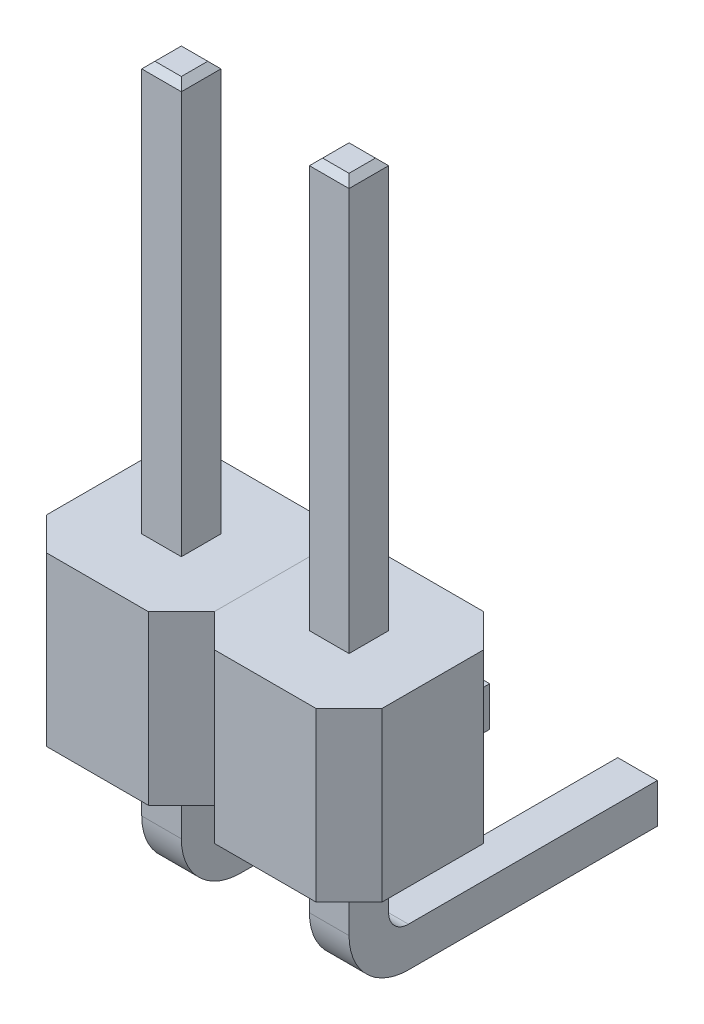
from build123d import *

# Parameters (mm, degrees)
CONTACT_DEPTH          = 0.3
CHAMFER1_SIZE          = 0.1
PLASTIC_DEPTH          = 2.54
PATTERN_LINEAR_2_COUNT = 2
PATTERN_LINEAR_2_PITCH = 2.54


with BuildPart() as part:
    # Sketch2 → Contact (new, symmetric)
    with BuildSketch(Plane(origin=(0, 0, 0), x_dir=(0, -1, 0), z_dir=(1, 0, 0))):
        with BuildLine():
            Line((0.3, 3.2), (-0.3, 3.2))
            Line((-0.3, 3.2), (-0.3, -0.67))
            ThreePointArc((-0.3, -0.67), (-0.387867966, -0.882132034), (-0.6, -0.97))
            Line((-0.6, -0.97), (-10.5, -0.97))
            Line((-10.5, -0.97), (-10.5, -1.57))
            Line((-10.5, -1.57), (-0.6, -1.57))
            ThreePointArc((-0.6, -1.57), (0.036396103, -1.306396103), (0.3, -0.67))
            Line((0.3, -0.67), (0.3, 3.2))
        make_face()
    extrude(amount=CONTACT_DEPTH, both=True)

    # Chamfer1
    chamfer1_edges = [part.edges().sort_by_distance(p)[0] for p in [
        (0.3, 10.5, 1.27),
        (0, 0.3, -3.2),
        (0, -0.3, -3.2),
        (0, 10.5, 1.57),
        (0, 10.5, 0.97),
        (0.3, 0, -3.2),
        (-0.3, 0, -3.2),
        (-0.3, 10.5, 1.27),
    ]]
    chamfer(chamfer1_edges, length=CHAMFER1_SIZE)

    # Sketch1 → Plastic (add)
    with BuildSketch(Plane(origin=(0, 4.3, 0), x_dir=(0, 0, -1), z_dir=(0, 1, 0))):
        Polygon((-2.04, 1.27), (-0.5, 1.27), (0, 0.77), (0, -0.77), (-0.5, -1.27), (-2.04, -1.27), (-2.54, -0.77), (-2.54, 0.77), align=None)
    extrude(amount=-PLASTIC_DEPTH)


with BuildPart() as pattern_linear_2_1:
    # Линейный массив2: pattern copy
    add(part.part.moved(Location(Vector(1, 0, 0) * (1 * PATTERN_LINEAR_2_PITCH))))


solid = Compound([part.part, pattern_linear_2_1.part])
